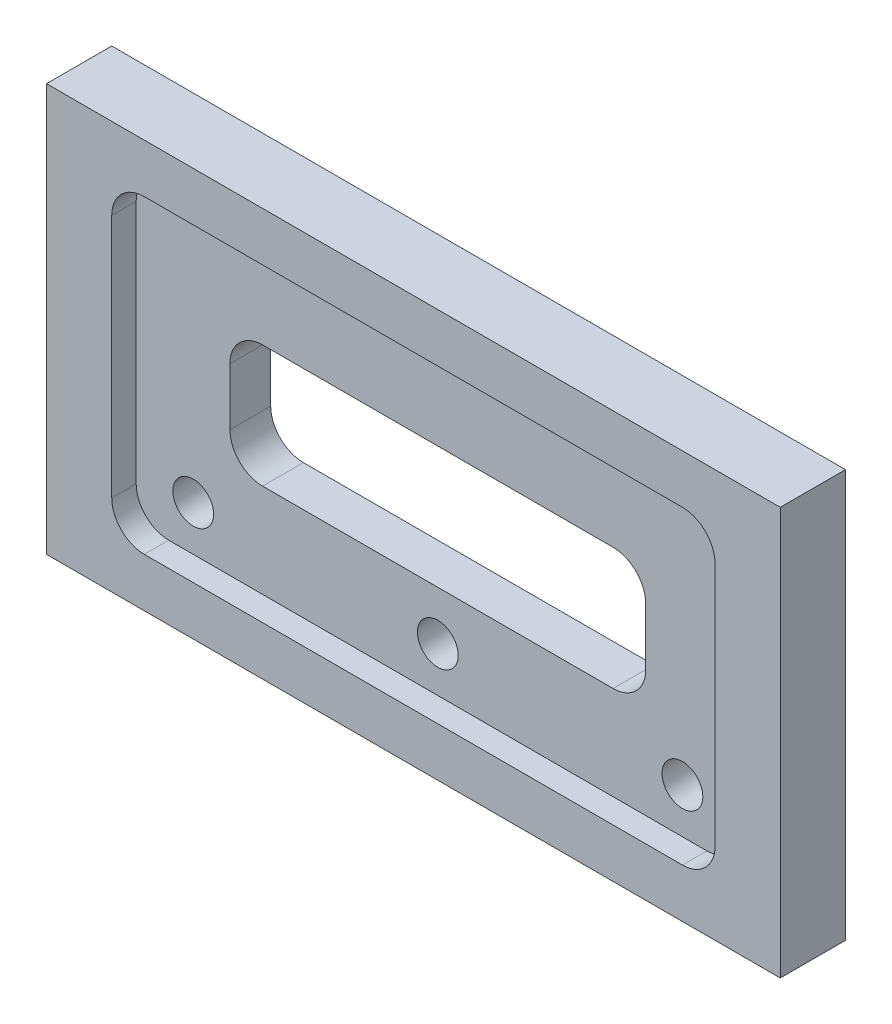
from build123d import *

# Parameters (mm, degrees)
SKETCH1_W             = 45
SKETCH1_H             = 25
BOSS_EXTRUDE1_DEPTH   = 4
SKETCH2_W             = 37
SKETCH2_H             = 19
CUT_EXTRUDE1_DEPTH    = 1.5
FILLET1_R             = 2
CUT_EXTRUDE2_DEPTH    = 26.860201082
F_2_5MM_DOWEL_HOLE1_D = 2.5


with BuildPart() as part:
    # Sketch1 → Boss-Extrude1 (new body)
    with BuildSketch(Plane.XY):
        Rectangle(SKETCH1_W, SKETCH1_H)
    extrude(amount=BOSS_EXTRUDE1_DEPTH)

    # Sketch2 → Cut-Extrude1 (cut)
    with BuildSketch(Plane.XY.offset(4)):
        Rectangle(SKETCH2_W, SKETCH2_H)
    extrude(amount=-CUT_EXTRUDE1_DEPTH, mode=Mode.SUBTRACT)

    # Fillet1
    fillet1_edges = [part.edges().sort_by_distance(p)[0] for p in [
        (18.5, 9.5, 3.25),
        (18.5, -9.5, 3.25),
        (-18.5, -9.5, 3.25),
        (-18.5, 9.5, 3.25),
    ]]
    fillet(fillet1_edges, radius=FILLET1_R)

    # Sketch3 → Cut-Extrude2 (cut, through all)
    with BuildSketch(Plane.XY.offset(2.5)):
        with BuildLine():
            Line((-10.75, -3.75), (10.75, -3.75))
            ThreePointArc((10.75, -3.75), (12.164213562, -3.164213562), (12.75, -1.75))
            Line((12.75, -1.75), (12.75, 1.75))
            ThreePointArc((12.75, 1.75), (12.164213562, 3.164213562), (10.75, 3.75))
            Line((10.75, 3.75), (-10.75, 3.75))
            ThreePointArc((-10.75, 3.75), (-12.164213562, 3.164213562), (-12.75, 1.75))
            Line((-12.75, 1.75), (-12.75, -1.75))
            ThreePointArc((-12.75, -1.75), (-12.164213562, -3.164213562), (-10.75, -3.75))
        make_face()
    extrude(amount=-CUT_EXTRUDE2_DEPTH, mode=Mode.SUBTRACT)

    # Ø2.5mm Dowel Hole1 (through all)
    with Locations(Plane.XY.offset(2.5)):
        with Locations((-15, -6.75), (0, -6.75), (15, -6.75)):
            Hole(F_2_5MM_DOWEL_HOLE1_D / 2)


solid = part.part
